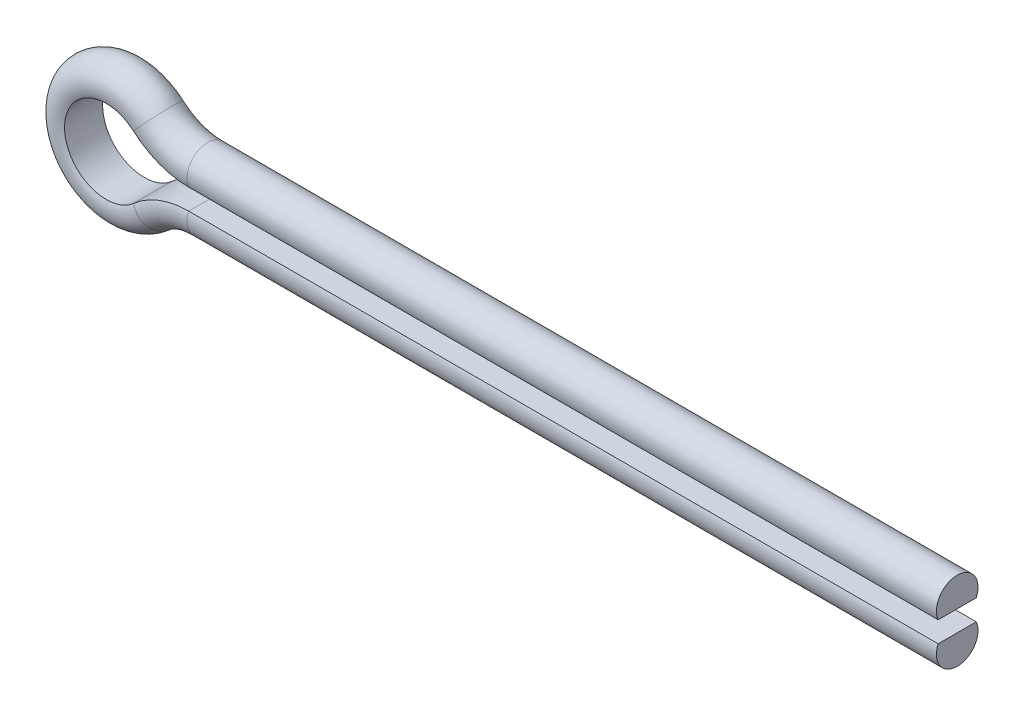
from build123d import *


with BuildPart() as part:
    # Sweep1: sweep along a path in Sketch1
    with BuildLine(Plane.XY) as sweep1_path:
        Line((100, 1.25), (9.921567416, 1.25))
        ThreePointArc((9.921567416, 1.25), (6.386033511, 1.895856533), (3.307189139, 3.75))
        ThreePointArc((3.307189139, 3.75), (-5, 0), (3.307189139, -3.75))
        ThreePointArc((3.307189139, -3.75), (6.386033511, -1.895856533), (9.921567416, -1.25))
        Line((9.921567416, -1.25), (100, -1.25))
    # Sketch2 → Sweep1 (sweep)
    with BuildSketch(Plane(origin=(100, 1.25, 0), x_dir=(0, 0, -1), z_dir=(1, 0, 0))):
        with BuildLine():
            Line((-2.291287847, 0), (2.291287847, 0))
            ThreePointArc((2.291287847, 0), (0, 3.5), (-2.291287847, 0))
        make_face()
    sweep(path=sweep1_path.line)


solid = part.part
